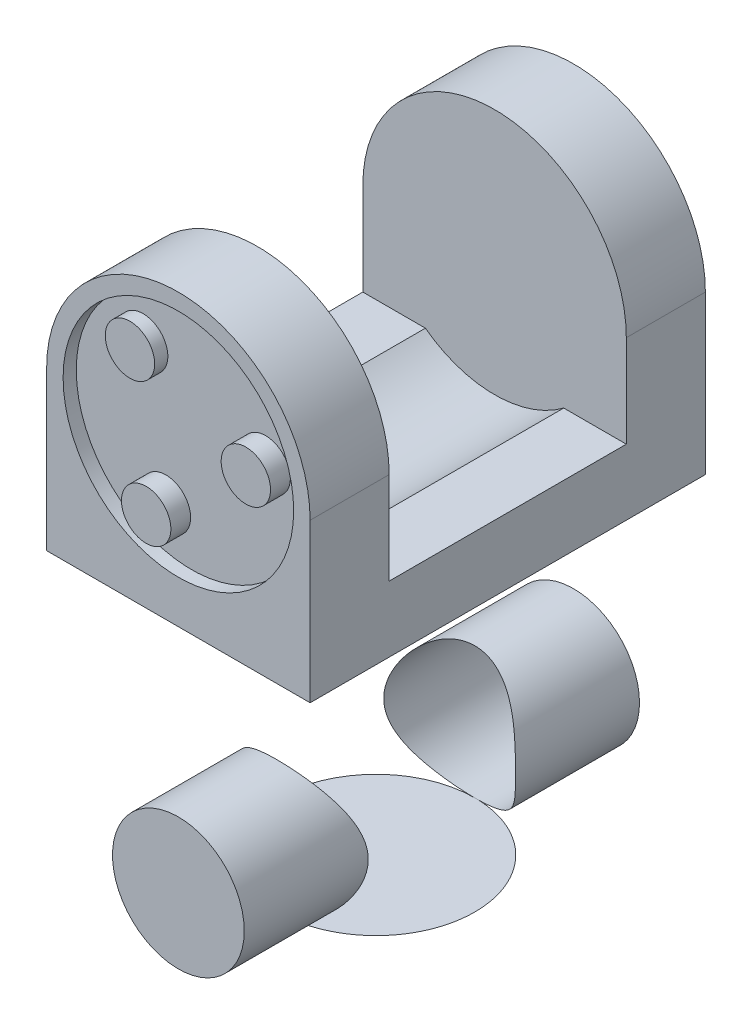
from build123d import *

# Parameters (mm, degrees)
SKETCH1_R           = 38.1
BOSS_EXTRUDE1_DEPTH = 127
SKETCH3_R           = 25.4
BOSS_EXTRUDE2_DEPTH = 152.4
SKETCH4_W           = 101.6
SKETCH4_H           = 152.4
BOSS_EXTRUDE3_DEPTH = 10.16
SKETCH5_W           = 101.6
SKETCH5_H           = 30.48
BOSS_EXTRUDE4_DEPTH = 101.6
CUT_EXTRUDE1_DEPTH  = 101.6
SKETCH8_R           = 44.45
SKETCH8_R_2         = 9.525
CUT_EXTRUDE3_DEPTH  = 5.08
BOSS_EXTRUDE6_START = 2.54
SKETCH8_6_R         = 9.525
BOSS_EXTRUDE6_DEPTH = 2.54
BOSS_EXTRUDE7_DEPTH = 121.92
SKETCH11_R          = 38.1
CUT_EXTRUDE5_DEPTH  = 12.7


with BuildPart() as part:
    # Sketch1 → Boss-Extrude1 (new body)
    with BuildSketch(Plane(origin=(0, 0, 0), x_dir=(1, 0, 0), z_dir=(0, 1, 0))):
        with Locations(Location((0, 0, 0), (0, 0, 270))):
            Circle(SKETCH1_R)
    extrude(amount=BOSS_EXTRUDE1_DEPTH)

    # Sketch3 → Boss-Extrude2 (add)
    with BuildSketch(Plane.XY.offset(76.2)):
        with Locations((0, 38.1)):
            Circle(SKETCH3_R)
    extrude(amount=-BOSS_EXTRUDE2_DEPTH)

    # Sketch4 → Boss-Extrude3 (add)
    with BuildSketch(Plane(origin=(0, 127, 0), x_dir=(1, 0, 0), z_dir=(0, 1, 0))):
        Rectangle(SKETCH4_W, SKETCH4_H)
    extrude(amount=BOSS_EXTRUDE3_DEPTH)

    # Sketch5 → Boss-Extrude4 (add)
    with BuildSketch(Plane(origin=(0, 137.16, 0), x_dir=(1, 0, 0), z_dir=(0, 1, 0))):
        with Locations((0, 60.96)):
            Rectangle(SKETCH5_W, SKETCH5_H)
    boss_extrude4 = extrude(amount=BOSS_EXTRUDE4_DEPTH)

    # Sketch7 → Cut-Extrude1 (cut)
    with BuildSketch(Plane(origin=(0, 0, -76.2), x_dir=(-1, 0, 0), z_dir=(0, 0, -1))):
        with BuildLine():
            ThreePointArc((-50.8, 187.96), (-35.92102454, 223.881024429), (-1.57e-07, 238.76))
            Line((-1.57e-07, 238.76), (-50.8, 238.76))
            Line((-50.8, 238.76), (-50.8, 187.96))
        make_face()
        with BuildLine():
            Line((50.8, 187.96), (50.8, 238.76))
            Line((50.8, 238.76), (-1.57e-07, 238.76))
            ThreePointArc((-1.57e-07, 238.76), (35.921024429, 223.88102454), (50.8, 187.96))
        make_face()
    cut_extrude1 = extrude(amount=-CUT_EXTRUDE1_DEPTH, mode=Mode.SUBTRACT)

    # Sketch8 → Cut-Extrude3 (cut)
    with BuildSketch(Plane(origin=(0, 0, -76.2), x_dir=(-1, 0, 0), z_dir=(0, 0, -1))):
        with Locations((0, 187.96)):
            Circle(SKETCH8_R)
        with Locations((-28.554667319, 193.031059488)):
            Circle(SKETCH8_R_2, mode=Mode.SUBTRACT)
        with Locations((9.885667319, 160.695402961)):
            Circle(SKETCH8_R_2, mode=Mode.SUBTRACT)
        with Locations((18.669, 210.153537551)):
            Circle(SKETCH8_R_2, mode=Mode.SUBTRACT)
    cut_extrude3 = extrude(amount=-CUT_EXTRUDE3_DEPTH, mode=Mode.SUBTRACT)

    # Sketch8<6> → Boss-Extrude6 (add)
    with BuildSketch(Plane(origin=(0, 0, -76.2), x_dir=(-1, 0, 0), z_dir=(0, 0, -1)).offset(BOSS_EXTRUDE6_START)):
        with Locations((-28.554667319, 193.031059488)):
            Circle(SKETCH8_6_R)
        with Locations((9.885667319, 160.695402961)):
            Circle(SKETCH8_6_R)
    boss_extrude6 = extrude(amount=-BOSS_EXTRUDE6_DEPTH)

    # Mirror2: Boss-Extrude4, Cut-Extrude1, Cut-Extrude3, Boss-Extrude6 across plane
    add(boss_extrude4.mirror(Plane.XY))
    add(cut_extrude1.mirror(Plane.XY), mode=Mode.SUBTRACT)
    add(cut_extrude3.mirror(Plane.XY), mode=Mode.SUBTRACT)
    add(boss_extrude6.mirror(Plane.XY))

    # Sketch10 → Boss-Extrude7 (add)
    with BuildSketch(Plane(origin=(0, 0, -76.2), x_dir=(-1, 0, 0), z_dir=(0, 0, -1))):
        with BuildLine():
            Line((-50.8, 152.4), (-26.67, 152.4))
            ThreePointArc((-26.67, 152.4), (0, 143.51), (26.67, 152.4))
            Line((26.67, 152.4), (50.8, 152.4))
            Line((50.8, 152.4), (50.8, 127))
            Line((50.8, 127), (-50.8, 127))
            Line((-50.8, 127), (-50.8, 152.4))
        make_face()
    extrude(amount=-BOSS_EXTRUDE7_DEPTH)

    # Sketch11 → Cut-Extrude5 (cut)
    with BuildSketch(Plane.XZ):
        with Locations(Location((0, 0, 0), (0, 0, 90))):
            Circle(SKETCH11_R)
    extrude(amount=-CUT_EXTRUDE5_DEPTH, mode=Mode.SUBTRACT)


solid = part.part
